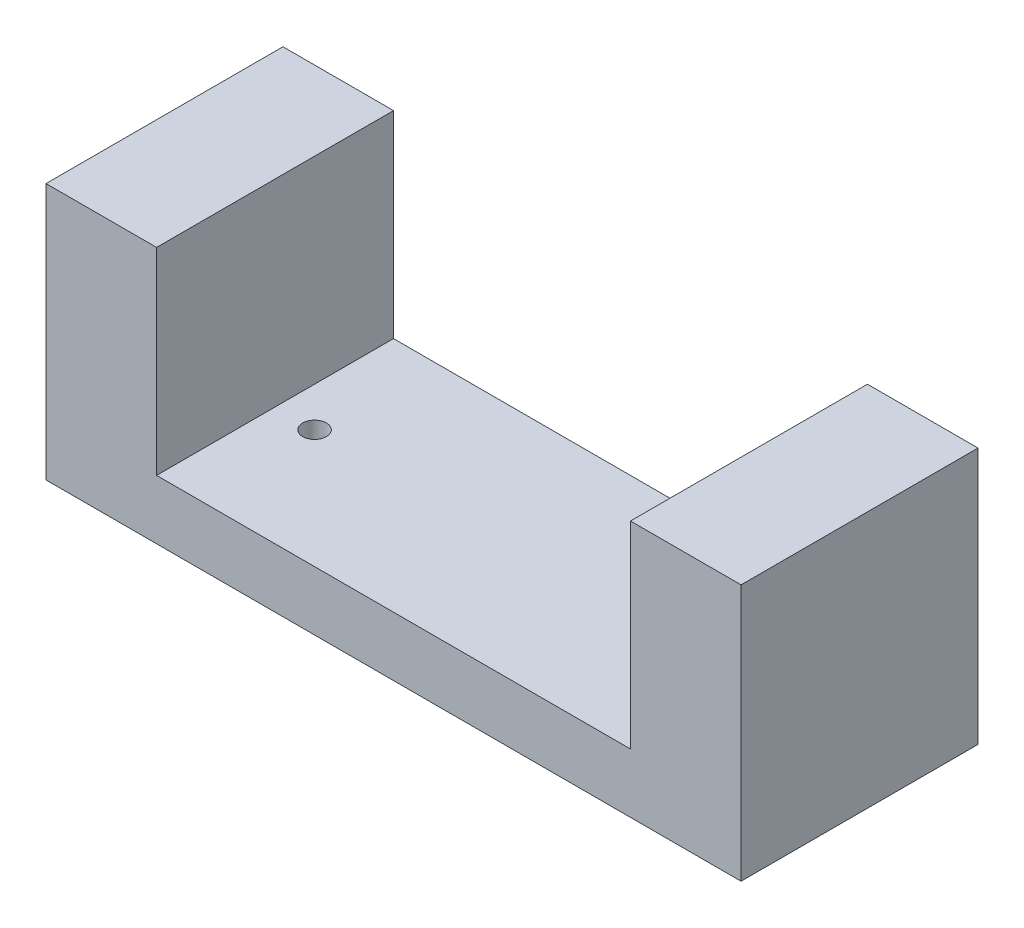
from build123d import *

# Parameters (mm, degrees)
SKETCH_1_W          = 88
SKETCH_1_H          = 30
EXTRUDE_1_DEPTH     = 32.5
SKETCH_2_R          = 1.5
CUT_EXTRUDE_1_DEPTH = 57.72080747
SKETCH_3_W          = 60
SKETCH_3_H          = 30
CUT_EXTRUDE_2_DEPTH = 25


with BuildPart() as part:
    # 草图1 → 凸台-拉伸1 (new body)
    with BuildSketch(Plane(origin=(0, 0, 0), x_dir=(1, 0, 0), z_dir=(0, 1, 0))):
        Rectangle(SKETCH_1_W, SKETCH_1_H)
    extrude(amount=EXTRUDE_1_DEPTH)

    # 草图2 → 切除-拉伸1 (cut, through all)
    with BuildSketch(Plane(origin=(0, 32.5, 0), x_dir=(1, 0, 0), z_dir=(0, 1, 0))):
        with Locations(Location((-25, 0, 0), (0, 0, 270))):
            Circle(SKETCH_2_R)
        with Locations(Location((25, 0, 0), (0, 0, 90))):
            Circle(SKETCH_2_R)
    extrude(amount=-CUT_EXTRUDE_1_DEPTH, mode=Mode.SUBTRACT)

    # 草图3 → 切除-拉伸2 (cut)
    with BuildSketch(Plane(origin=(0, 32.5, 0), x_dir=(1, 0, 0), z_dir=(0, 1, 0))):
        Rectangle(SKETCH_3_W, SKETCH_3_H)
    extrude(amount=-CUT_EXTRUDE_2_DEPTH, mode=Mode.SUBTRACT)


solid = part.part
